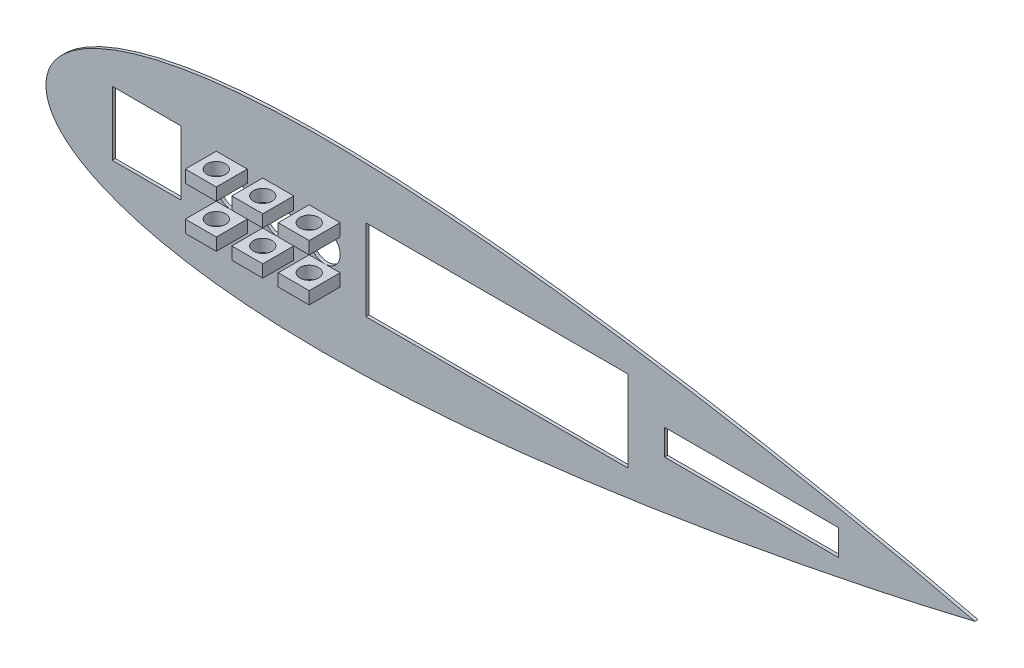
from build123d import *

# Parameters (mm, degrees)
EXTRUDE_1_DEPTH          = 1
SKETCH_2_R               = 5
CUT_EXTRUDE_2_DEPTH      = 302.498287555
SKETCH_7_W               = 10
SKETCH_7_H               = 4
EXTRUDE_2_DEPTH          = 10
CUT_EXTRUDE_3_DEPTH      = 303.724763765
CUT_EXTRUDE_3_DEPTH_BACK = 303.724763765
SKETCH_8_R               = 3
SKETCH_9_W               = 84.692171331
SKETCH_9_H               = 26.273118844
SKETCH_9_W_2             = 56.255383877
SKETCH_9_H_2             = 8.345578926
SKETCH_9_W_3             = 22.254877138
SKETCH_9_H_3             = 20.70939956
CUT_EXTRUDE_4_DEPTH      = 302.662422914


with BuildPart() as part:
    # 草图1 → 凸台-拉伸1 (new body)
    with BuildSketch(Plane.XY):
        with BuildLine():
            add(Edge.make_bspline(
                [(0, 0), (-0.00021229, 0.506970744), (0.044864754, 1.381714413), (0.226017079, 2.650839475), (0.688025344, 4.299952552), (1.335546305, 5.873041675), (2.26695445, 7.542579189), (3.571946964, 9.346109572), (5.391381815, 11.324673938), (7.954469743, 13.539518757), (11.584975672, 16.021510412), (16.648123966, 18.726988569), (23.793189999, 21.649781435), (33.085765079, 24.436937203), (46.643058908, 27.284493785), (64.063199307, 29.362693495), (84.450847037, 30.260343335), (107.414943041, 29.859960777), (130.332556147, 28.428346139), (153.186136376, 26.214758658), (175.970846287, 23.391654718), (195.848592789, 20.487628812), (212.844945694, 17.732999103), (226.980485609, 15.27094618), (238.271313866, 13.203878393), (248.135151077, 11.310105462), (256.577305747, 9.625486685), (263.604664912, 8.179483676), (269.219788458, 6.997398786), (274.1309907, 5.93944771), (278.331979904, 5.017052178), (281.838528118, 4.234963306), (284.626645762, 3.606112196), (287.446648095, 2.96209323), (290.200347561, 2.326575377), (293.076089097, 1.653806717), (295.700233888, 1.034172197), (298.078453529, 0.464134201), (299.36547076, 0.153714708), (299.999999998, 0)],
                knots=[0, 0, 0, 0, 0, 0.005874531, 0.010168378, 0.014828146, 0.019835444, 0.025574736, 0.032308878, 0.040609511, 0.050966894, 0.064812119, 0.083253248, 0.107120705, 0.140429682, 0.177263566, 0.243881637, 0.310499708, 0.377117784, 0.443735861, 0.510353937, 0.576972013, 0.643590091, 0.67689913, 0.710208169, 0.743517207, 0.776826246, 0.793480766, 0.810135286, 0.826789806, 0.843444325, 0.851771585, 0.860098845, 0.868426105, 0.876753365, 0.885080625, 0.893407884, 0.901735144, 0.910062404, 0.910062404, 0.910062404, 0.910062404, 0.910062404], degree=4))
            add(Edge.make_bspline(
                [(0, 0), (-0.00021229, -0.506970744), (0.044864754, -1.381714413), (0.226017079, -2.650839475), (0.688025344, -4.299952552), (1.335546305, -5.873041675), (2.26695445, -7.542579189), (3.571946964, -9.346109572), (5.391381815, -11.324673938), (7.954469743, -13.539518757), (11.584975672, -16.021510412), (16.648123966, -18.726988569), (23.793189999, -21.649781435), (33.085765079, -24.436937203), (46.643058908, -27.284493785), (64.063199307, -29.362693495), (84.450847037, -30.260343335), (107.414943041, -29.859960777), (130.332556147, -28.428346139), (153.186136376, -26.214758658), (175.970846287, -23.391654718), (195.848592789, -20.487628812), (212.844945694, -17.732999103), (226.980485609, -15.27094618), (238.271313866, -13.203878393), (248.135151077, -11.310105462), (256.577305747, -9.625486685), (263.604664912, -8.179483676), (269.219788458, -6.997398786), (274.1309907, -5.93944771), (278.331979904, -5.017052178), (281.838528118, -4.234963306), (284.626645762, -3.606112196), (287.446648095, -2.96209323), (290.200347561, -2.326575377), (293.076089097, -1.653806717), (295.700233888, -1.034172197), (298.078453529, -0.464134201), (299.36547076, -0.153714708), (299.999999998, 0)],
                knots=[0, 0, 0, 0, 0, 0.005874531, 0.010168378, 0.014828146, 0.019835444, 0.025574736, 0.032308878, 0.040609511, 0.050966894, 0.064812119, 0.083253248, 0.107120705, 0.140429682, 0.177263566, 0.243881637, 0.310499708, 0.377117784, 0.443735861, 0.510353937, 0.576972013, 0.643590091, 0.67689913, 0.710208169, 0.743517207, 0.776826246, 0.793480766, 0.810135286, 0.826789806, 0.843444325, 0.851771585, 0.860098845, 0.868426105, 0.876753365, 0.885080625, 0.893407884, 0.901735144, 0.910062404, 0.910062404, 0.910062404, 0.910062404, 0.910062404], degree=4))
        make_face()
    extrude(amount=EXTRUDE_1_DEPTH)

    # 草图2 → 切除-拉伸2 (cut, through all)
    with BuildSketch(Plane.XY.offset(1)):
        with Locations((60, 0)):
            Circle(SKETCH_2_R)
        with Locations((75, 0)):
            Circle(SKETCH_2_R)
        with Locations((90, 0)):
            Circle(SKETCH_2_R)
    extrude(amount=-CUT_EXTRUDE_2_DEPTH, mode=Mode.SUBTRACT)

    # 草图7 → 凸台-拉伸2 (add)
    with BuildSketch(Plane.XY.offset(1)):
        with Locations((60, 7)):
            Rectangle(SKETCH_7_W, SKETCH_7_H)
        with Locations((60, -7)):
            Rectangle(SKETCH_7_W, SKETCH_7_H)
        with Locations((75, 7)):
            Rectangle(SKETCH_7_W, SKETCH_7_H)
        with Locations((75, -7)):
            Rectangle(SKETCH_7_W, SKETCH_7_H)
        with Locations((90, 7)):
            Rectangle(SKETCH_7_W, SKETCH_7_H)
        with Locations((90, -7)):
            Rectangle(SKETCH_7_W, SKETCH_7_H)
    extrude(amount=EXTRUDE_2_DEPTH)

    # 草图8 → 切除-拉伸3 (cut, two sides: drawn at the far end of the back side and taken through both)
    with BuildSketch(Plane.XZ.offset(9).offset(-CUT_EXTRUDE_3_DEPTH_BACK)):
        with Locations(Location((90, 6, 0), (0, 0, 270))):
            Circle(SKETCH_8_R)
        with Locations(Location((75, 6, 0), (0, 0, 270))):
            Circle(SKETCH_8_R)
        with Locations(Location((60, 6, 0), (0, 0, 270))):
            Circle(SKETCH_8_R)
    extrude(amount=CUT_EXTRUDE_3_DEPTH + CUT_EXTRUDE_3_DEPTH_BACK, mode=Mode.SUBTRACT)

    # 草图9 → 切除-拉伸4 (cut, through all)
    with BuildSketch(Plane.XY.offset(1)):
        with Locations((145.672556633, 0)):
            Rectangle(SKETCH_9_W, SKETCH_9_H)
        with Locations((227.891963838, 0)):
            Rectangle(SKETCH_9_W_2, SKETCH_9_H_2)
        with Locations((32.543597847, 0)):
            Rectangle(SKETCH_9_W_3, SKETCH_9_H_3)
    extrude(amount=-CUT_EXTRUDE_4_DEPTH, mode=Mode.SUBTRACT)


solid = part.part
